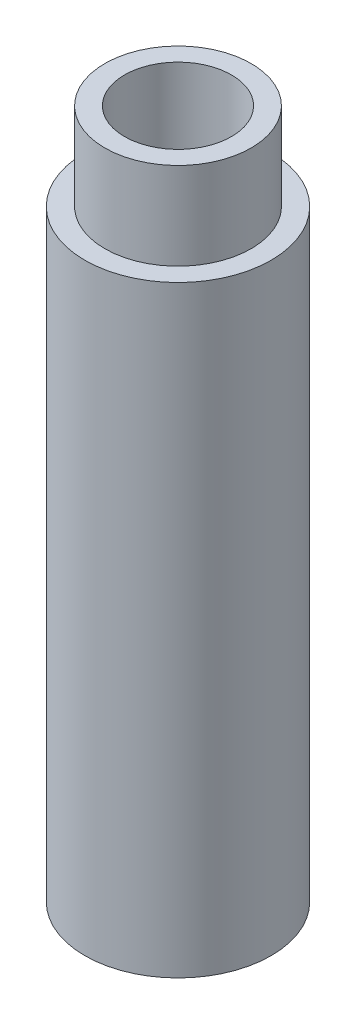
from build123d import *

# Parameters (mm, degrees)
SKETCH1_R           = 8.275
BOSS_EXTRUDE1_DEPTH = 61.25
CUT_EXTRUDE1_START  = -7.75
SKETCH2_R           = 8.275
SKETCH2_R_2         = 6.5
SKETCH2_R_3         = 4.75
CUT_EXTRUDE1_DEPTH  = 7.75
CUT_EXTRUDE3_START  = -51.5
SKETCH3_R           = 4.75
CUT_EXTRUDE3_DEPTH  = 51.5


with BuildPart() as part:
    # Sketch1 → Boss-Extrude1 (new body)
    with BuildSketch(Plane(origin=(0, 0, 0), x_dir=(1, 0, 0), z_dir=(0, 1, 0))):
        with Locations(Location((0, 0, 0), (0, 0, 270))):
            Circle(SKETCH1_R)
    extrude(amount=BOSS_EXTRUDE1_DEPTH)

    # Sketch2 → Cut-Extrude1 (cut)
    # profile 1 of 2: a face of its own
    with BuildSketch(Plane(origin=(0, 61.25, 0), x_dir=(1, 0, 0), z_dir=(0, 1, 0)).offset(CUT_EXTRUDE1_START)):
        with Locations(Location((0, 0, 0), (0, 0, 270))):
            Circle(SKETCH2_R)
        with Locations(Location((0, 0, 0), (0, 0, 270))):
            Circle(SKETCH2_R_2, mode=Mode.SUBTRACT)
    # profile 2 of 2: a face of its own
    with BuildSketch(Plane(origin=(0, 61.25, 0), x_dir=(1, 0, 0), z_dir=(0, 1, 0)).offset(CUT_EXTRUDE1_START)):
        with Locations(Location((0, 0, 0), (0, 0, 270))):
            Circle(SKETCH2_R_3)
    extrude(amount=CUT_EXTRUDE1_DEPTH, mode=Mode.SUBTRACT)

    # Sketch3 → Cut-Extrude3 (cut)
    with BuildSketch(Plane(origin=(0, 53.5, 0), x_dir=(1, 0, 0), z_dir=(0, 1, 0)).offset(CUT_EXTRUDE3_START)):
        with Locations(Location((0, 0, 0), (0, 0, 270))):
            Circle(SKETCH3_R)
    extrude(amount=CUT_EXTRUDE3_DEPTH, mode=Mode.SUBTRACT)


solid = part.part
